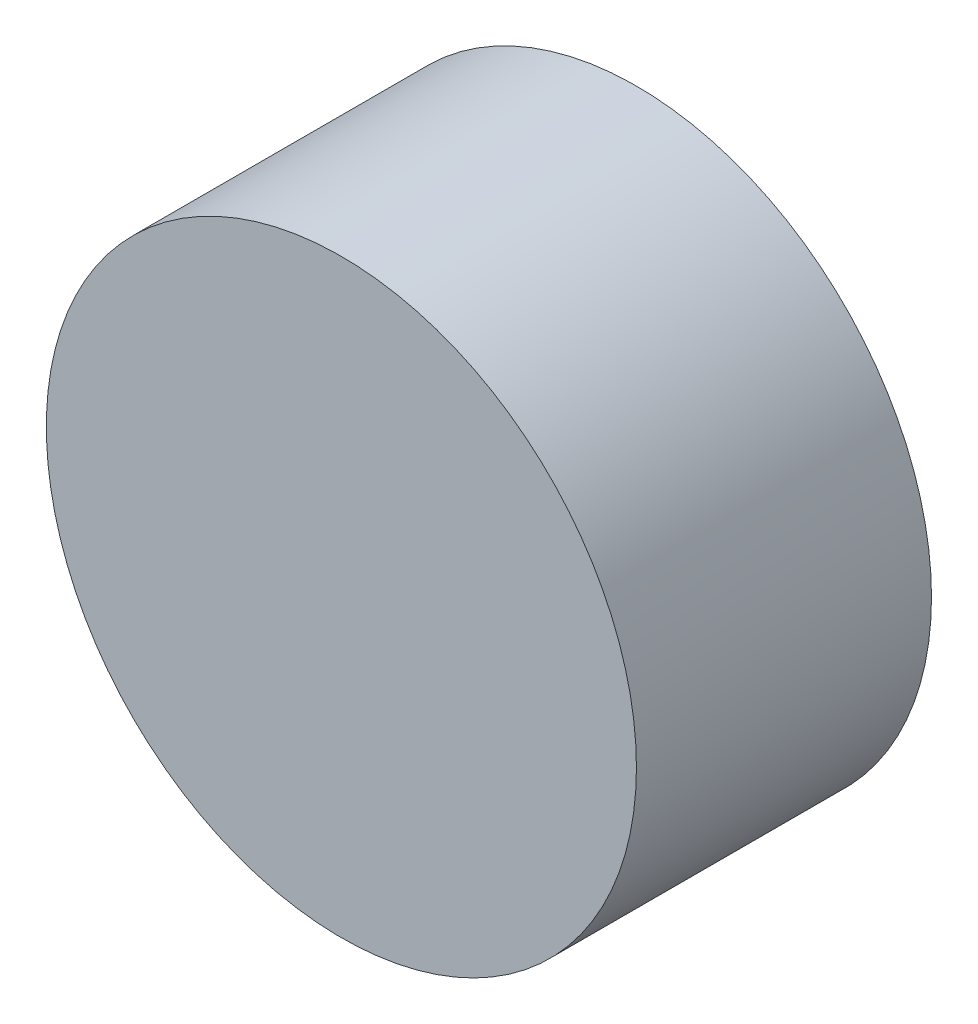
from build123d import *

# Parameters (mm, degrees)
CROQUIS1_R              = 10
SALIENTE_EXTRUIR1_DEPTH = 10


with BuildPart() as part:
    # Croquis1 → Saliente-Extruir1 (new body)
    with BuildSketch(Plane.XY):
        Circle(CROQUIS1_R)
    extrude(amount=SALIENTE_EXTRUIR1_DEPTH)


solid = part.part
